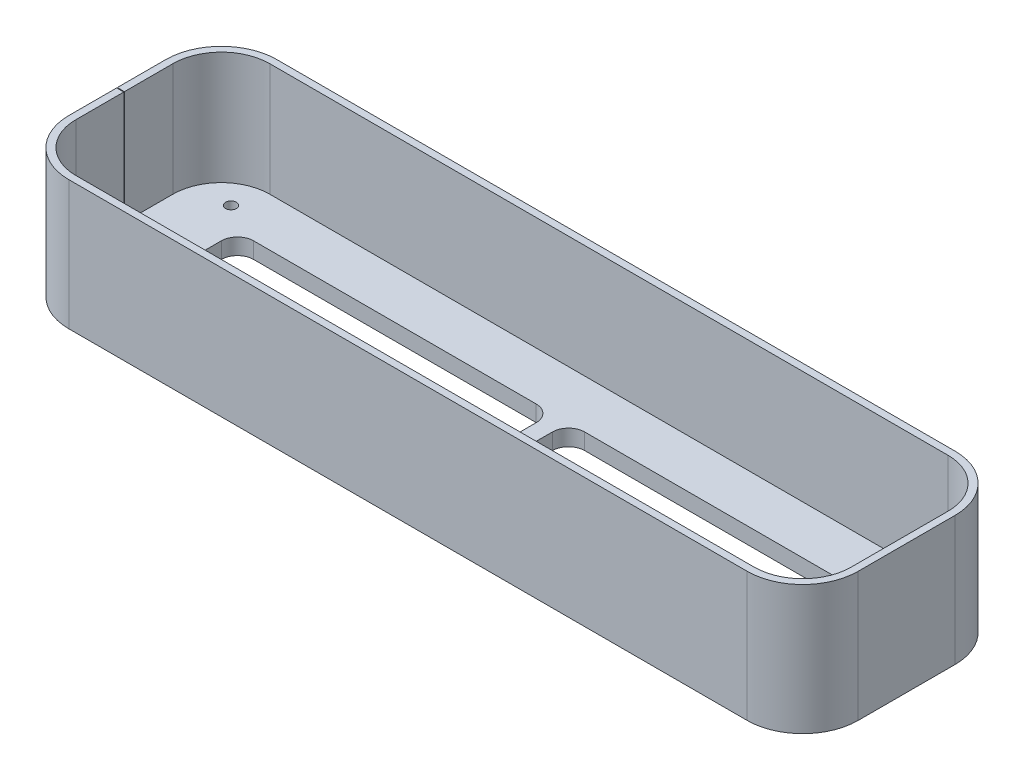
from build123d import *

# Parameters (mm, degrees)
SKETCH1_W           = 304.8
SKETCH1_H           = 76.2
BOSS_EXTRUDE1_DEPTH = 6.35
SKETCH2_W           = 254
SKETCH2_H           = 38.1
CUT_EXTRUDE1_DEPTH  = 158.21861372
SKETCH3_W           = 6.35
SKETCH3_H           = 38.1
BOSS_EXTRUDE2_DEPTH = 6.35
FILLET1_R           = 19.05
FILLET2_R           = 6.35
SKETCH4_R           = 2.13995
CUT_EXTRUDE2_DEPTH  = 158.21861372
BOSS_EXTRUDE3_DEPTH = 50.8


with BuildPart() as part:
    # Sketch1 → Boss-Extrude1 (new body)
    with BuildSketch(Plane(origin=(0, 0, 0), x_dir=(1, 0, 0), z_dir=(0, 1, 0))):
        Rectangle(SKETCH1_W, SKETCH1_H)
    extrude(amount=BOSS_EXTRUDE1_DEPTH)

    # Sketch2 → Cut-Extrude1 (cut, through all)
    with BuildSketch(Plane(origin=(0, 6.35, 0), x_dir=(1, 0, 0), z_dir=(0, 1, 0))):
        Rectangle(SKETCH2_W, SKETCH2_H)
    extrude(amount=-CUT_EXTRUDE1_DEPTH, mode=Mode.SUBTRACT)

    # Sketch3 → Boss-Extrude2 (add)
    with BuildSketch(Plane(origin=(0, 6.35, 0), x_dir=(1, 0, 0), z_dir=(0, 1, 0))):
        Rectangle(SKETCH3_W, SKETCH3_H)
    extrude(amount=-BOSS_EXTRUDE2_DEPTH)

    # Fillet1
    fillet1_edges = [part.edges().sort_by_distance(p)[0] for p in [
        (152.4, 3.175, 38.1),
        (-152.4, 3.175, 38.1),
        (-152.4, 3.175, -38.1),
        (152.4, 3.175, -38.1),
    ]]
    fillet(fillet1_edges, radius=FILLET1_R)

    # Fillet2
    fillet2_edges = [part.edges().sort_by_distance(p)[0] for p in [
        (127, 3.175, -19.05),
        (127, 3.175, 19.05),
        (-127, 3.175, 19.05),
        (-127, 3.175, -19.05),
        (3.175, 3.175, -19.05),
        (3.175, 3.175, 19.05),
        (-3.175, 3.175, 19.05),
        (-3.175, 3.175, -19.05),
    ]]
    fillet(fillet2_edges, radius=FILLET2_R)

    # Sketch4 → Cut-Extrude2 (cut, through all)
    with BuildSketch(Plane(origin=(0, 6.35, 0), x_dir=(1, 0, 0), z_dir=(0, 1, 0))):
        with Locations(Location((137.16, 26.67, 0), (0, 0, 270))):
            Circle(SKETCH4_R)
        with Locations(Location((137.16, -26.67, 0), (0, 0, 270))):
            Circle(SKETCH4_R)
        with Locations(Location((-137.16, -26.67, 0), (0, 0, 270))):
            Circle(SKETCH4_R)
        with Locations(Location((-137.16, 26.67, 0), (0, 0, 270))):
            Circle(SKETCH4_R)
    extrude(amount=-CUT_EXTRUDE2_DEPTH, mode=Mode.SUBTRACT)


with BuildPart() as body_2:
    # Sketch5 → Boss-Extrude3 (new body)
    with BuildSketch(Plane(origin=(0, 0, 0), x_dir=(1, 0, 0), z_dir=(0, 1, 0))):
        with BuildLine():
            Line((-155.194, 19.05), (-155.194, 0))
            Line((-155.194, 0), (-152.4, 0))
            Line((-152.4, 0), (-152.4, 19.05))
            ThreePointArc((-152.4, 19.05), (-146.820384182, 32.520384182), (-133.35, 38.1))
            Line((-133.35, 38.1), (133.35, 38.1))
            ThreePointArc((133.35, 38.1), (146.820384182, 32.520384182), (152.4, 19.05))
            Line((152.4, 19.05), (152.4, -19.05))
            ThreePointArc((152.4, -19.05), (146.820384182, -32.520384182), (133.35, -38.1))
            Line((133.35, -38.1), (-133.35, -38.1))
            ThreePointArc((-133.35, -38.1), (-146.820384182, -32.520384182), (-152.4, -19.05))
            Line((-152.4, -19.05), (-152.4, -0.254))
            Line((-152.4, -0.254), (-155.194, -0.254))
            Line((-155.194, -0.254), (-155.194, -19.05))
            ThreePointArc((-155.194, -19.05), (-148.796040528, -34.496040528), (-133.35, -40.894))
            Line((-133.35, -40.894), (133.35, -40.894))
            ThreePointArc((133.35, -40.894), (148.796040528, -34.496040528), (155.194, -19.05))
            Line((155.194, -19.05), (155.194, 19.05))
            ThreePointArc((155.194, 19.05), (148.796040528, 34.496040528), (133.35, 40.894))
            Line((133.35, 40.894), (-133.35, 40.894))
            ThreePointArc((-133.35, 40.894), (-148.796040528, 34.496040528), (-155.194, 19.05))
        make_face()
    extrude(amount=BOSS_EXTRUDE3_DEPTH)


solid = Compound([part.part, body_2.part])
